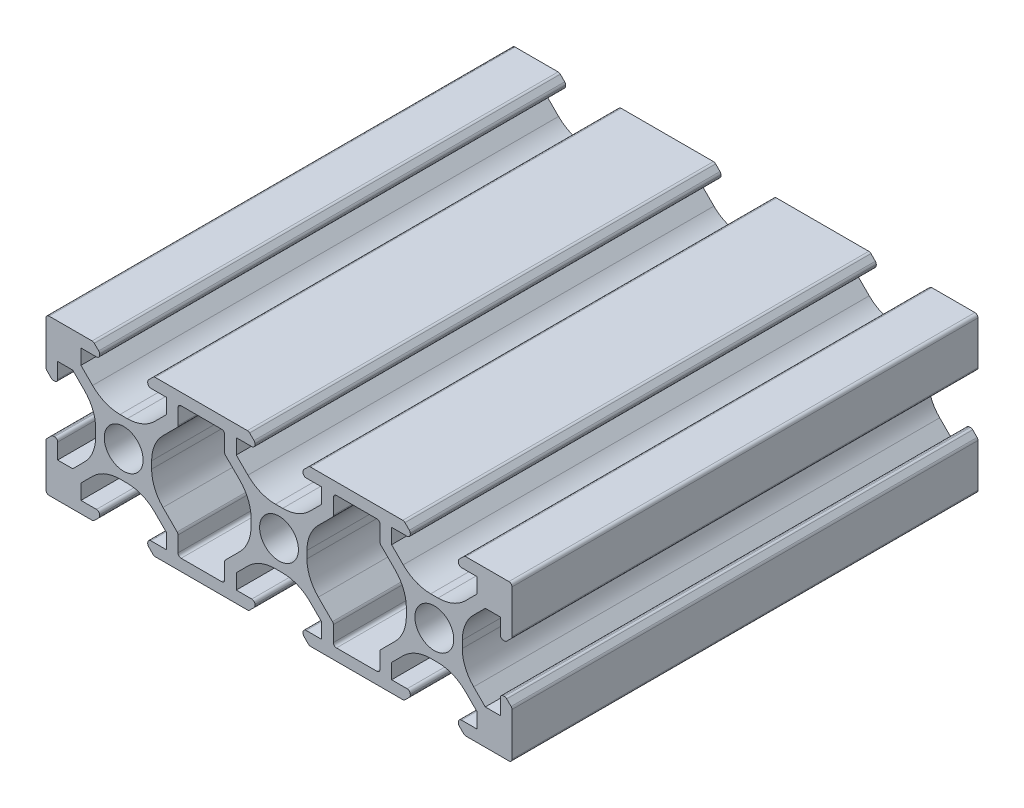
from build123d import *

# Parameters (mm, degrees)
RESSALTO_EXTRUS_O1_DEPTH    = 60
PADR_OCIRCULAR1_COUNT       = 4
PADR_O_LINEAR1_COUNT        = 3
PADR_O_LINEAR1_PITCH        = 20
PADR_O_LINEAR1_COPY_1_DEPTH = 60
PADR_O_LINEAR1_COPY_2_DEPTH = 60
PADR_O_LINEAR1_COPY_3_DEPTH = 60
PADR_O_LINEAR1_COPY_4_DEPTH = 60
PADR_O_LINEAR1_COPY_5_DEPTH = 60
PADR_O_LINEAR1_COPY_6_DEPTH = 60
CORTE_EXTRUS_O1_DEPTH       = 79.74007874
PADR_O_LINEAR2_COUNT        = 2
PADR_O_LINEAR2_PITCH        = 20
FILETE1_R                   = 0.4
FILETE2_R                   = 0.4


with BuildPart() as part:
    # Esboço1 → Ressalto-extrusão1 (new body)
    with BuildSketch(Plane.XY):
        with BuildLine():
            ThreePointArc((-9.317157288, 3.217157288), (-9.187387948, 3.130448187), (-9.034314575, 3.1))
            Line((-9.034314575, 3.1), (-8.9, 3.1))
            ThreePointArc((-8.9, 3.1), (-8.617157288, 3.217157288), (-8.5, 3.5))
            Line((-8.5, 3.5), (-8.5, 5.5))
            Line((-8.5, 5.5), (-6.560660172, 5.5))
            Line((-6.560660172, 5.5), (-5.064466094, 4.003805922))
            ThreePointArc((-5.064466094, 4.003805922), (-3.980602337, 2.381689178), (-3.6, 0.468272016))
            Line((-3.6, 0.468272016), (-3.6, 0))
            Line((-3.6, 0), (-2.5, 0))
            ThreePointArc((-2.5, 0), (-1.767766953, 1.767766953), (0, 2.5))
            Line((0, 2.5), (0, 3.6))
            Line((0, 3.6), (-0.468272016, 3.6))
            ThreePointArc((-0.468272016, 3.6), (-2.381689178, 3.980602337), (-4.003805922, 5.064466094))
            Line((-4.003805922, 5.064466094), (-5.5, 6.560660172))
            Line((-5.5, 6.560660172), (-5.5, 8.5))
            Line((-5.5, 8.5), (-3.5, 8.5))
            ThreePointArc((-3.5, 8.5), (-3.217157288, 8.617157288), (-3.1, 8.9))
            Line((-3.1, 8.9), (-3.1, 9.034314575))
            ThreePointArc((-3.1, 9.034314575), (-3.130448187, 9.187387948), (-3.217157288, 9.317157288))
            Line((-3.217157288, 9.317157288), (-3.782842712, 9.882842712))
            ThreePointArc((-3.782842712, 9.882842712), (-3.912612052, 9.969551813), (-4.065685425, 10))
            Line((-4.065685425, 10), (-10, 10))
            Line((-10, 10), (-10, 4.065685425))
            ThreePointArc((-10, 4.065685425), (-9.969551813, 3.912612052), (-9.882842712, 3.782842712))
            Line((-9.882842712, 3.782842712), (-9.317157288, 3.217157288))
        make_face()
    ressalto_extrus_o1 = extrude(amount=RESSALTO_EXTRUS_O1_DEPTH)

    # PadrãoCircular1: Ressalto-extrusão1 ×4 about axis
    padr_ocircular1_axis = Axis((0, 0, 0), (0, 0, 1))
    for i in range(1, PADR_OCIRCULAR1_COUNT):
        add(ressalto_extrus_o1.rotate(padr_ocircular1_axis, i * 360 / PADR_OCIRCULAR1_COUNT))

    # Padrão linear1: Ressalto-extrusão1 ×3
    with Locations(*[(i * PADR_O_LINEAR1_PITCH, 0, 0) for i in range(1, PADR_O_LINEAR1_COUNT)]):
        add(ressalto_extrus_o1)

    # Padrão linear1 copy 1 sketch → Padrão linear1 copy 1 (add)
    with BuildSketch(Plane(origin=(20, 0, 0), x_dir=(0, 1, 0), z_dir=(0, 0, 1))):
        with BuildLine():
            ThreePointArc((-9.317157288, 3.217157288), (-9.187387948, 3.130448187), (-9.034314575, 3.1))
            Line((-9.034314575, 3.1), (-8.9, 3.1))
            ThreePointArc((-8.9, 3.1), (-8.617157288, 3.217157288), (-8.5, 3.5))
            Line((-8.5, 3.5), (-8.5, 5.5))
            Line((-8.5, 5.5), (-6.560660172, 5.5))
            Line((-6.560660172, 5.5), (-5.064466094, 4.003805922))
            ThreePointArc((-5.064466094, 4.003805922), (-3.980602337, 2.381689178), (-3.6, 0.468272016))
            Line((-3.6, 0.468272016), (-3.6, 0))
            Line((-3.6, 0), (-2.5, 0))
            ThreePointArc((-2.5, 0), (-1.767766953, 1.767766953), (0, 2.5))
            Line((0, 2.5), (0, 3.6))
            Line((0, 3.6), (-0.468272016, 3.6))
            ThreePointArc((-0.468272016, 3.6), (-2.381689178, 3.980602337), (-4.003805922, 5.064466094))
            Line((-4.003805922, 5.064466094), (-5.5, 6.560660172))
            Line((-5.5, 6.560660172), (-5.5, 8.5))
            Line((-5.5, 8.5), (-3.5, 8.5))
            ThreePointArc((-3.5, 8.5), (-3.217157288, 8.617157288), (-3.1, 8.9))
            Line((-3.1, 8.9), (-3.1, 9.034314575))
            ThreePointArc((-3.1, 9.034314575), (-3.130448187, 9.187387948), (-3.217157288, 9.317157288))
            Line((-3.217157288, 9.317157288), (-3.782842712, 9.882842712))
            ThreePointArc((-3.782842712, 9.882842712), (-3.912612052, 9.969551813), (-4.065685425, 10))
            Line((-4.065685425, 10), (-10, 10))
            Line((-10, 10), (-10, 4.065685425))
            ThreePointArc((-10, 4.065685425), (-9.969551813, 3.912612052), (-9.882842712, 3.782842712))
            Line((-9.882842712, 3.782842712), (-9.317157288, 3.217157288))
        make_face()
    extrude(amount=PADR_O_LINEAR1_COPY_1_DEPTH)

    # Padrão linear1 copy 2 sketch → Padrão linear1 copy 2 (add)
    with BuildSketch(Plane(origin=(40, 0, 0), x_dir=(0, 1, 0), z_dir=(0, 0, 1))):
        with BuildLine():
            ThreePointArc((-9.317157288, 3.217157288), (-9.187387948, 3.130448187), (-9.034314575, 3.1))
            Line((-9.034314575, 3.1), (-8.9, 3.1))
            ThreePointArc((-8.9, 3.1), (-8.617157288, 3.217157288), (-8.5, 3.5))
            Line((-8.5, 3.5), (-8.5, 5.5))
            Line((-8.5, 5.5), (-6.560660172, 5.5))
            Line((-6.560660172, 5.5), (-5.064466094, 4.003805922))
            ThreePointArc((-5.064466094, 4.003805922), (-3.980602337, 2.381689178), (-3.6, 0.468272016))
            Line((-3.6, 0.468272016), (-3.6, 0))
            Line((-3.6, 0), (-2.5, 0))
            ThreePointArc((-2.5, 0), (-1.767766953, 1.767766953), (0, 2.5))
            Line((0, 2.5), (0, 3.6))
            Line((0, 3.6), (-0.468272016, 3.6))
            ThreePointArc((-0.468272016, 3.6), (-2.381689178, 3.980602337), (-4.003805922, 5.064466094))
            Line((-4.003805922, 5.064466094), (-5.5, 6.560660172))
            Line((-5.5, 6.560660172), (-5.5, 8.5))
            Line((-5.5, 8.5), (-3.5, 8.5))
            ThreePointArc((-3.5, 8.5), (-3.217157288, 8.617157288), (-3.1, 8.9))
            Line((-3.1, 8.9), (-3.1, 9.034314575))
            ThreePointArc((-3.1, 9.034314575), (-3.130448187, 9.187387948), (-3.217157288, 9.317157288))
            Line((-3.217157288, 9.317157288), (-3.782842712, 9.882842712))
            ThreePointArc((-3.782842712, 9.882842712), (-3.912612052, 9.969551813), (-4.065685425, 10))
            Line((-4.065685425, 10), (-10, 10))
            Line((-10, 10), (-10, 4.065685425))
            ThreePointArc((-10, 4.065685425), (-9.969551813, 3.912612052), (-9.882842712, 3.782842712))
            Line((-9.882842712, 3.782842712), (-9.317157288, 3.217157288))
        make_face()
    extrude(amount=PADR_O_LINEAR1_COPY_2_DEPTH)

    # Padrão linear1 copy 3 sketch → Padrão linear1 copy 3 (add)
    with BuildSketch(Plane(origin=(20, 0, 0), x_dir=(-1, 0, 0), z_dir=(0, 0, 1))):
        with BuildLine():
            ThreePointArc((-9.317157288, 3.217157288), (-9.187387948, 3.130448187), (-9.034314575, 3.1))
            Line((-9.034314575, 3.1), (-8.9, 3.1))
            ThreePointArc((-8.9, 3.1), (-8.617157288, 3.217157288), (-8.5, 3.5))
            Line((-8.5, 3.5), (-8.5, 5.5))
            Line((-8.5, 5.5), (-6.560660172, 5.5))
            Line((-6.560660172, 5.5), (-5.064466094, 4.003805922))
            ThreePointArc((-5.064466094, 4.003805922), (-3.980602337, 2.381689178), (-3.6, 0.468272016))
            Line((-3.6, 0.468272016), (-3.6, 0))
            Line((-3.6, 0), (-2.5, 0))
            ThreePointArc((-2.5, 0), (-1.767766953, 1.767766953), (0, 2.5))
            Line((0, 2.5), (0, 3.6))
            Line((0, 3.6), (-0.468272016, 3.6))
            ThreePointArc((-0.468272016, 3.6), (-2.381689178, 3.980602337), (-4.003805922, 5.064466094))
            Line((-4.003805922, 5.064466094), (-5.5, 6.560660172))
            Line((-5.5, 6.560660172), (-5.5, 8.5))
            Line((-5.5, 8.5), (-3.5, 8.5))
            ThreePointArc((-3.5, 8.5), (-3.217157288, 8.617157288), (-3.1, 8.9))
            Line((-3.1, 8.9), (-3.1, 9.034314575))
            ThreePointArc((-3.1, 9.034314575), (-3.130448187, 9.187387948), (-3.217157288, 9.317157288))
            Line((-3.217157288, 9.317157288), (-3.782842712, 9.882842712))
            ThreePointArc((-3.782842712, 9.882842712), (-3.912612052, 9.969551813), (-4.065685425, 10))
            Line((-4.065685425, 10), (-10, 10))
            Line((-10, 10), (-10, 4.065685425))
            ThreePointArc((-10, 4.065685425), (-9.969551813, 3.912612052), (-9.882842712, 3.782842712))
            Line((-9.882842712, 3.782842712), (-9.317157288, 3.217157288))
        make_face()
    extrude(amount=PADR_O_LINEAR1_COPY_3_DEPTH)

    # Padrão linear1 copy 4 sketch → Padrão linear1 copy 4 (add)
    with BuildSketch(Plane(origin=(40, 0, 0), x_dir=(-1, 0, 0), z_dir=(0, 0, 1))):
        with BuildLine():
            ThreePointArc((-9.317157288, 3.217157288), (-9.187387948, 3.130448187), (-9.034314575, 3.1))
            Line((-9.034314575, 3.1), (-8.9, 3.1))
            ThreePointArc((-8.9, 3.1), (-8.617157288, 3.217157288), (-8.5, 3.5))
            Line((-8.5, 3.5), (-8.5, 5.5))
            Line((-8.5, 5.5), (-6.560660172, 5.5))
            Line((-6.560660172, 5.5), (-5.064466094, 4.003805922))
            ThreePointArc((-5.064466094, 4.003805922), (-3.980602337, 2.381689178), (-3.6, 0.468272016))
            Line((-3.6, 0.468272016), (-3.6, 0))
            Line((-3.6, 0), (-2.5, 0))
            ThreePointArc((-2.5, 0), (-1.767766953, 1.767766953), (0, 2.5))
            Line((0, 2.5), (0, 3.6))
            Line((0, 3.6), (-0.468272016, 3.6))
            ThreePointArc((-0.468272016, 3.6), (-2.381689178, 3.980602337), (-4.003805922, 5.064466094))
            Line((-4.003805922, 5.064466094), (-5.5, 6.560660172))
            Line((-5.5, 6.560660172), (-5.5, 8.5))
            Line((-5.5, 8.5), (-3.5, 8.5))
            ThreePointArc((-3.5, 8.5), (-3.217157288, 8.617157288), (-3.1, 8.9))
            Line((-3.1, 8.9), (-3.1, 9.034314575))
            ThreePointArc((-3.1, 9.034314575), (-3.130448187, 9.187387948), (-3.217157288, 9.317157288))
            Line((-3.217157288, 9.317157288), (-3.782842712, 9.882842712))
            ThreePointArc((-3.782842712, 9.882842712), (-3.912612052, 9.969551813), (-4.065685425, 10))
            Line((-4.065685425, 10), (-10, 10))
            Line((-10, 10), (-10, 4.065685425))
            ThreePointArc((-10, 4.065685425), (-9.969551813, 3.912612052), (-9.882842712, 3.782842712))
            Line((-9.882842712, 3.782842712), (-9.317157288, 3.217157288))
        make_face()
    extrude(amount=PADR_O_LINEAR1_COPY_4_DEPTH)

    # Padrão linear1 copy 5 sketch → Padrão linear1 copy 5 (add)
    with BuildSketch(Plane(origin=(20, 0, 0), x_dir=(0, -1, 0), z_dir=(0, 0, 1))):
        with BuildLine():
            ThreePointArc((-9.317157288, 3.217157288), (-9.187387948, 3.130448187), (-9.034314575, 3.1))
            Line((-9.034314575, 3.1), (-8.9, 3.1))
            ThreePointArc((-8.9, 3.1), (-8.617157288, 3.217157288), (-8.5, 3.5))
            Line((-8.5, 3.5), (-8.5, 5.5))
            Line((-8.5, 5.5), (-6.560660172, 5.5))
            Line((-6.560660172, 5.5), (-5.064466094, 4.003805922))
            ThreePointArc((-5.064466094, 4.003805922), (-3.980602337, 2.381689178), (-3.6, 0.468272016))
            Line((-3.6, 0.468272016), (-3.6, 0))
            Line((-3.6, 0), (-2.5, 0))
            ThreePointArc((-2.5, 0), (-1.767766953, 1.767766953), (0, 2.5))
            Line((0, 2.5), (0, 3.6))
            Line((0, 3.6), (-0.468272016, 3.6))
            ThreePointArc((-0.468272016, 3.6), (-2.381689178, 3.980602337), (-4.003805922, 5.064466094))
            Line((-4.003805922, 5.064466094), (-5.5, 6.560660172))
            Line((-5.5, 6.560660172), (-5.5, 8.5))
            Line((-5.5, 8.5), (-3.5, 8.5))
            ThreePointArc((-3.5, 8.5), (-3.217157288, 8.617157288), (-3.1, 8.9))
            Line((-3.1, 8.9), (-3.1, 9.034314575))
            ThreePointArc((-3.1, 9.034314575), (-3.130448187, 9.187387948), (-3.217157288, 9.317157288))
            Line((-3.217157288, 9.317157288), (-3.782842712, 9.882842712))
            ThreePointArc((-3.782842712, 9.882842712), (-3.912612052, 9.969551813), (-4.065685425, 10))
            Line((-4.065685425, 10), (-10, 10))
            Line((-10, 10), (-10, 4.065685425))
            ThreePointArc((-10, 4.065685425), (-9.969551813, 3.912612052), (-9.882842712, 3.782842712))
            Line((-9.882842712, 3.782842712), (-9.317157288, 3.217157288))
        make_face()
    extrude(amount=PADR_O_LINEAR1_COPY_5_DEPTH)

    # Padrão linear1 copy 6 sketch → Padrão linear1 copy 6 (add)
    with BuildSketch(Plane(origin=(40, 0, 0), x_dir=(0, -1, 0), z_dir=(0, 0, 1))):
        with BuildLine():
            ThreePointArc((-9.317157288, 3.217157288), (-9.187387948, 3.130448187), (-9.034314575, 3.1))
            Line((-9.034314575, 3.1), (-8.9, 3.1))
            ThreePointArc((-8.9, 3.1), (-8.617157288, 3.217157288), (-8.5, 3.5))
            Line((-8.5, 3.5), (-8.5, 5.5))
            Line((-8.5, 5.5), (-6.560660172, 5.5))
            Line((-6.560660172, 5.5), (-5.064466094, 4.003805922))
            ThreePointArc((-5.064466094, 4.003805922), (-3.980602337, 2.381689178), (-3.6, 0.468272016))
            Line((-3.6, 0.468272016), (-3.6, 0))
            Line((-3.6, 0), (-2.5, 0))
            ThreePointArc((-2.5, 0), (-1.767766953, 1.767766953), (0, 2.5))
            Line((0, 2.5), (0, 3.6))
            Line((0, 3.6), (-0.468272016, 3.6))
            ThreePointArc((-0.468272016, 3.6), (-2.381689178, 3.980602337), (-4.003805922, 5.064466094))
            Line((-4.003805922, 5.064466094), (-5.5, 6.560660172))
            Line((-5.5, 6.560660172), (-5.5, 8.5))
            Line((-5.5, 8.5), (-3.5, 8.5))
            ThreePointArc((-3.5, 8.5), (-3.217157288, 8.617157288), (-3.1, 8.9))
            Line((-3.1, 8.9), (-3.1, 9.034314575))
            ThreePointArc((-3.1, 9.034314575), (-3.130448187, 9.187387948), (-3.217157288, 9.317157288))
            Line((-3.217157288, 9.317157288), (-3.782842712, 9.882842712))
            ThreePointArc((-3.782842712, 9.882842712), (-3.912612052, 9.969551813), (-4.065685425, 10))
            Line((-4.065685425, 10), (-10, 10))
            Line((-10, 10), (-10, 4.065685425))
            ThreePointArc((-10, 4.065685425), (-9.969551813, 3.912612052), (-9.882842712, 3.782842712))
            Line((-9.882842712, 3.782842712), (-9.317157288, 3.217157288))
        make_face()
    extrude(amount=PADR_O_LINEAR1_COPY_6_DEPTH)

    # Esboço4 → Corte-extrusão1 (cut, through all)
    with BuildSketch(Plane(origin=(0, 0, 0), x_dir=(-1, 0, 0), z_dir=(0, 0, -1))):
        Polygon((-13.439339828, 5.5), (-13, 5.939339828), (-13, 8.5), (-7, 8.5), (-7, 5.939339828), (-6.560660172, 5.5), (-6.560660172, -5.5), (-7, -5.939339828), (-7, -8.5), (-13, -8.5), (-13, -5.939339828), (-13.439339828, -5.5), align=None)
    corte_extrus_o1 = extrude(amount=-CORTE_EXTRUS_O1_DEPTH, mode=Mode.SUBTRACT)

    # Padrão linear2: Corte-extrusão1 ×2
    with Locations(*[(i * PADR_O_LINEAR2_PITCH, 0, 0) for i in range(1, PADR_O_LINEAR2_COUNT)]):
        add(corte_extrus_o1, mode=Mode.SUBTRACT)

    # Filete1
    filete1_edges = [part.edges().sort_by_distance(p)[0] for p in [
        (13, 5.939339828, 30),
        (13, 8.5, 30),
        (7, 8.5, 30),
        (7, 5.939339828, 30),
        (7, -5.939339828, 30),
        (7, -8.5, 30),
        (13, -8.5, 30),
        (13, -5.939339828, 30),
        (33, 5.939339828, 30),
        (33, 8.5, 30),
        (27, 8.5, 30),
        (27, 5.939339828, 30),
        (27, -5.939339828, 30),
        (27, -8.5, 30),
        (33, -8.5, 30),
        (33, -5.939339828, 30),
    ]]
    fillet(filete1_edges, radius=FILETE1_R)

    # Filete2
    filete2_edges = [part.edges().sort_by_distance(p)[0] for p in [
        (-10, 10, 30),
        (50, -10, 30),
        (50, 10, 30),
        (-10, -10, 30),
    ]]
    fillet(filete2_edges, radius=FILETE2_R)


solid = part.part
